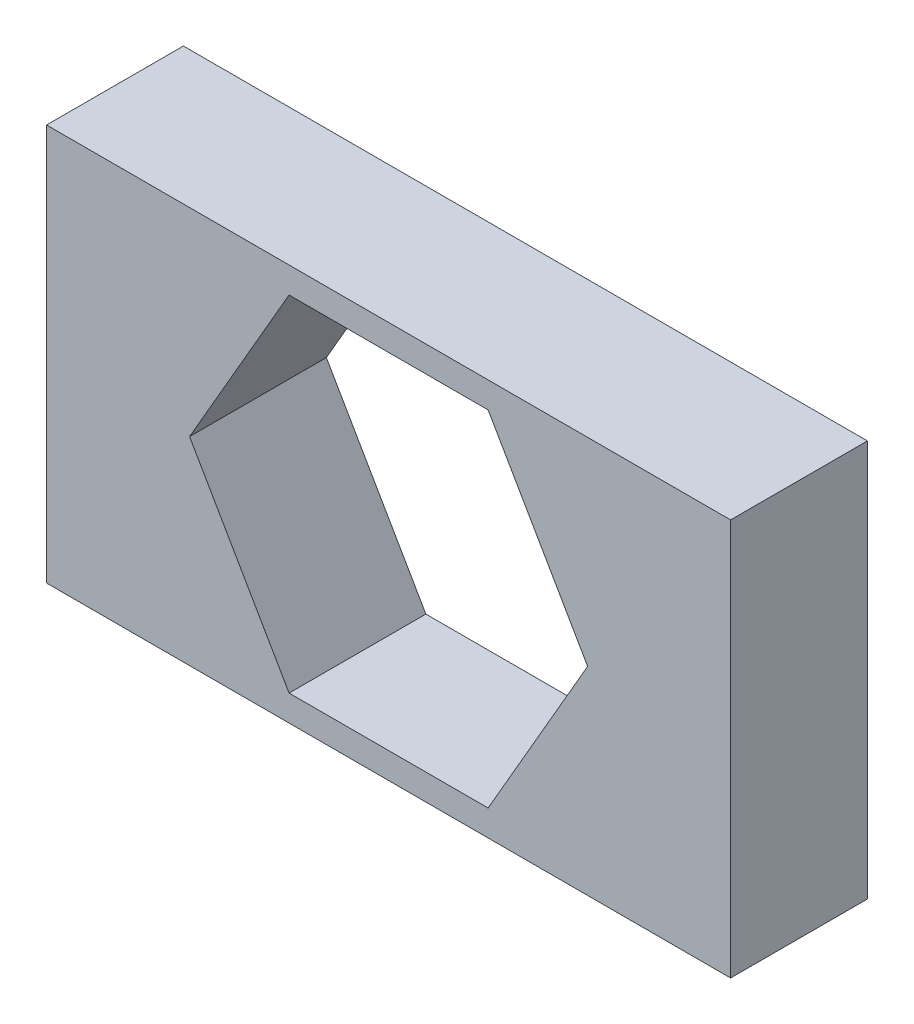
from build123d import *

# Parameters (mm, degrees)
ESQUISSE1_W        = 25
ESQUISSE1_H        = 14.5
BOSS_EXTRU_1_DEPTH = 5


with BuildPart() as part:
    # Esquisse1 → Boss.-Extru.1 (new body)
    with BuildSketch(Plane.XY):
        with Locations((12.5, 7.25)):
            Rectangle(ESQUISSE1_W, ESQUISSE1_H)
        Polygon((19.774613392, 7.25), (16.137306696, 13.55), (8.862693304, 13.55), (5.225386608, 7.25), (8.862693304, 0.95), (16.137306696, 0.95), align=None, mode=Mode.SUBTRACT)
    extrude(amount=BOSS_EXTRU_1_DEPTH)


solid = part.part
